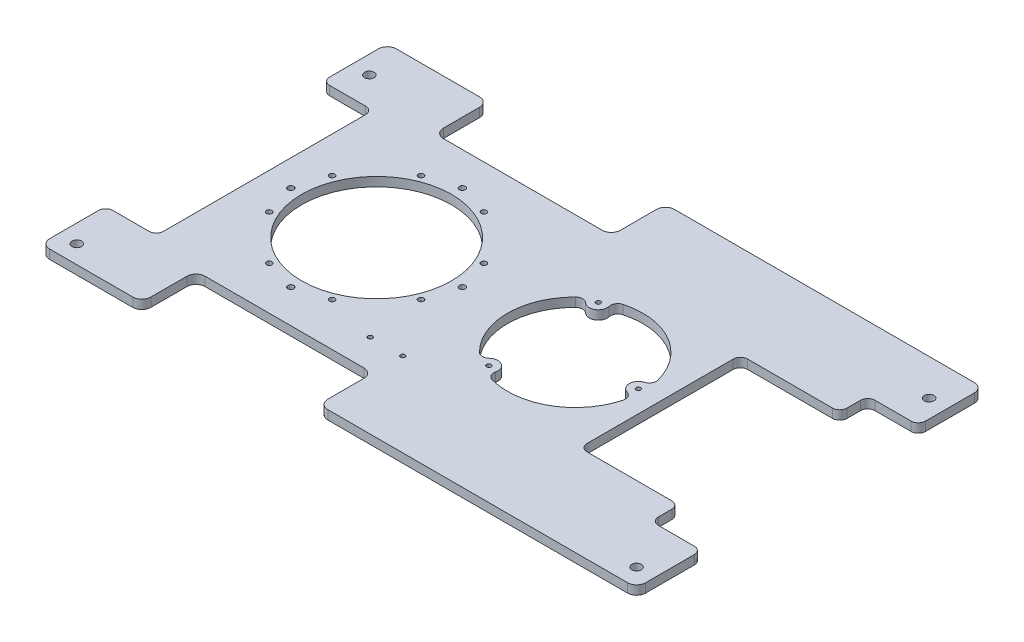
from build123d import *

# Parameters (mm, degrees)
SKETCH1_W                = 330
SKETCH1_H                = 192
BOSS_EXTRUDE1_DEPTH      = 5
CUT_EXTRUDE1_DEPTH       = 382.823257542
CUT_EXTRUDE1_DEPTH_BACK  = 382.823257542
SKETCH2_R                = 1.5
SKETCH3_R                = 41.5
CUT_EXTRUDE2_DEPTH       = 382.823257542
M5_CLEARANCE_HOLE1_D     = 5.3
M5_CLEARANCE_HOLE1_DEPTH = 11.94
M5_CLEARANCE_HOLE1_TIP   = 1.59228064
TAP_DRILL_FOR_M4_TAP1_D  = 3.3
CUT_EXTRUDE3_DEPTH       = 382.823257542
CUT_EXTRUDE3_DEPTH_BACK  = 382.823257542
SKETCH19_W               = 28
SKETCH19_H               = 120
SKETCH21_W               = 55
SKETCH21_H               = 89
CUT_EXTRUDE4_DEPTH       = 382.823257542
FILLET1_R                = 4
TAP_DRILL_FOR_M3_TAP1_D  = 2.5
TAP_DRILL_FOR_M3_TAP2_D  = 2.5
CUT_EXTRUDE5_DEPTH       = 382.823257542
FILLET2_R                = 4
SKETCH33_W               = 98
SKETCH33_H               = 30
CUT_EXTRUDE6_DEPTH       = 382.82325768
FILLET3_R                = 5


with BuildPart() as part:
    # Sketch1 → Boss-Extrude1 (new body)
    with BuildSketch(Plane(origin=(0, 0, 0), x_dir=(1, 0, 0), z_dir=(0, 1, 0))):
        with Locations((165, 96)):
            Rectangle(SKETCH1_W, SKETCH1_H)
    extrude(amount=BOSS_EXTRUDE1_DEPTH)

    # Sketch2 → Cut-Extrude1 (cut, two sides: drawn at the far end of the back side and taken through both)
    with BuildSketch(Plane(origin=(0, 5, 0), x_dir=(1, 0, 0), z_dir=(0, 1, 0)).offset(-CUT_EXTRUDE1_DEPTH_BACK)):
        with Locations(Location((132.036518729, 113.412096173, 0), (0, 0, 270))):
            Circle(SKETCH2_R)
        with Locations(Location((132.036518729, 78.587903827, 0), (0, 0, 270))):
            Circle(SKETCH2_R)
        with Locations(Location((107.412096173, 53.963481271, 0), (0, 0, 270))):
            Circle(SKETCH2_R)
        with Locations(Location((72.587903827, 53.963481271, 0), (0, 0, 270))):
            Circle(SKETCH2_R)
        with Locations(Location((47.963481271, 78.587903827, 0), (0, 0, 270))):
            Circle(SKETCH2_R)
        with Locations(Location((47.963481271, 113.412096173, 0), (0, 0, 270))):
            Circle(SKETCH2_R)
        with Locations(Location((72.587903827, 138.036518729, 0), (0, 0, 270))):
            Circle(SKETCH2_R)
        with Locations(Location((107.412096173, 138.036518729, 0), (0, 0, 270))):
            Circle(SKETCH2_R)
    extrude(amount=CUT_EXTRUDE1_DEPTH + CUT_EXTRUDE1_DEPTH_BACK, mode=Mode.SUBTRACT)

    # Sketch3 → Cut-Extrude2 (cut, through all)
    with BuildSketch(Plane(origin=(0, 5, 0), x_dir=(1, 0, 0), z_dir=(0, 1, 0))):
        with Locations(Location((90, 96, 0), (0, 0, 270))):
            Circle(SKETCH3_R)
    extrude(amount=-CUT_EXTRUDE2_DEPTH, mode=Mode.SUBTRACT)

    # M5 Clearance Hole1
    with Locations(Plane(origin=(0, 5, 0), x_dir=(1, 0, 0), z_dir=(0, 1, 0))):
        with Locations((10, 172), (10, 10), (320, 10), (320, 172)):
            Hole(M5_CLEARANCE_HOLE1_D / 2, depth=M5_CLEARANCE_HOLE1_DEPTH)
            with Locations((0, 0, -(M5_CLEARANCE_HOLE1_DEPTH + M5_CLEARANCE_HOLE1_TIP / 2))):  # 118° drill point
                Cone(0, M5_CLEARANCE_HOLE1_D / 2, M5_CLEARANCE_HOLE1_TIP, mode=Mode.SUBTRACT)

    # Tap Drill for M4 Tap1 (through all)
    with Locations(Plane(origin=(0, 5, 0), x_dir=(1, 0, 0), z_dir=(0, 1, 0))):
        with Locations((137.5, 96), (90, 48.5), (42.5, 96), (90, 143.5)):
            Hole(TAP_DRILL_FOR_M4_TAP1_D / 2)

    # Sketch19 → Cut-Extrude3 (cut, two sides: drawn at the far end of the back side and taken through both)
    with BuildSketch(Plane(origin=(0, 5, 0), x_dir=(1, 0, 0), z_dir=(0, 1, 0)).offset(-CUT_EXTRUDE3_DEPTH_BACK)):
        with Locations((14, 96)):
            Rectangle(SKETCH19_W, SKETCH19_H)
        with Locations((316, 96)):
            Rectangle(SKETCH19_W, SKETCH19_H)
    extrude(amount=CUT_EXTRUDE3_DEPTH + CUT_EXTRUDE3_DEPTH_BACK, mode=Mode.SUBTRACT)

    # Sketch21 → Cut-Extrude4 (cut, through all)
    with BuildSketch(Plane.XZ):
        with Locations((274.5, -96)):
            Rectangle(SKETCH21_W, SKETCH21_H)
    extrude(amount=-CUT_EXTRUDE4_DEPTH, mode=Mode.SUBTRACT)

    # Fillet1
    fillet1_edges = [part.edges().sort_by_distance(p)[0] for p in [
        (0, 2.5, -36),
        (0, 2.5, -156),
        (28, 2.5, -156),
        (28, 2.5, -36),
        (330, 2.5, -156),
        (330, 2.5, -36),
        (302, 2.5, -36),
        (302, 2.5, -156),
        (302, 2.5, -51.5),
        (302, 2.5, -140.5),
        (247, 2.5, -140.5),
        (247, 2.5, -51.5),
    ]]
    fillet(fillet1_edges, radius=FILLET1_R)

    # Tap Drill for M3 Tap1 (through all)
    with Locations(Plane(origin=(0, 0, 0), x_dir=(-1, 0, 0), z_dir=(0, -1, 0))):
        with Locations((-182.5, 126.310889132), (-182.5, 65.689110868), (-235, 96)):
            Hole(TAP_DRILL_FOR_M3_TAP1_D / 2)

    # Tap Drill for M3 Tap2 (through all)
    with Locations(Plane(origin=(0, 0, 0), x_dir=(-1, 0, 0), z_dir=(0, -1, 0))):
        with Locations((-154, 46.5), (-136, 46.5)):
            Hole(TAP_DRILL_FOR_M3_TAP2_D / 2)

    # Sketch32 → Cut-Extrude5 (cut, through all)
    with BuildSketch(Plane.XZ):
        with BuildLine():
            ThreePointArc((237.232142857, -100.474096363), (230, -96), (237.232142857, -91.525903637))
            ThreePointArc((237.232142857, -91.525903637), (218.75, -63.524047358), (185.258609681, -61.518970267))
            ThreePointArc((185.258609681, -61.518970267), (186.904148522, -63.321944672), (187.5, -65.689110868))
            ThreePointArc((187.5, -65.689110868), (182.6520482, -70.686798467), (177.509247462, -65.99306663))
            ThreePointArc((177.509247462, -65.99306663), (162.5, -96), (177.509247462, -126.00693337))
            ThreePointArc((177.509247462, -126.00693337), (182.6520482, -121.313201533), (187.5, -126.310889132))
            ThreePointArc((187.5, -126.310889132), (186.904148522, -128.678055328), (185.258609681, -130.481029733))
            ThreePointArc((185.258609681, -130.481029733), (218.75, -128.475952642), (237.232142857, -100.474096363))
        make_face()
    extrude(amount=-CUT_EXTRUDE5_DEPTH, mode=Mode.SUBTRACT)

    # Fillet2
    fillet2_edges = [part.edges().sort_by_distance(p)[0] for p in [
        (237.232142857, 2.5, -91.525903637),
        (237.232142857, 2.5, -100.474096363),
        (185.258609681, 2.5, -130.481029733),
        (177.509247462, 2.5, -126.00693337),
        (177.509247462, 2.5, -65.99306663),
        (185.258609681, 2.5, -61.518970267),
    ]]
    fillet(fillet2_edges, radius=FILLET2_R)

    # Sketch33 → Cut-Extrude6 (cut, through all)
    with BuildSketch(Plane.XZ):
        with Locations((105, -15)):
            Rectangle(SKETCH33_W, SKETCH33_H)
        with Locations((105, -177)):
            Rectangle(SKETCH33_W, SKETCH33_H)
    extrude(amount=-CUT_EXTRUDE6_DEPTH, mode=Mode.SUBTRACT)

    # Fillet3
    fillet3_edges = [part.edges().sort_by_distance(p)[0] for p in [
        (56, 2.5, -30),
        (56, 2.5, 0),
        (154, 2.5, 0),
        (154, 2.5, -30),
        (56, 2.5, -192),
        (56, 2.5, -162),
        (154, 2.5, -162),
        (154, 2.5, -192),
        (0, 2.5, -192),
        (330, 2.5, -192),
        (330, 2.5, 0),
        (0, 2.5, 0),
    ]]
    fillet(fillet3_edges, radius=FILLET3_R)


solid = part.part
